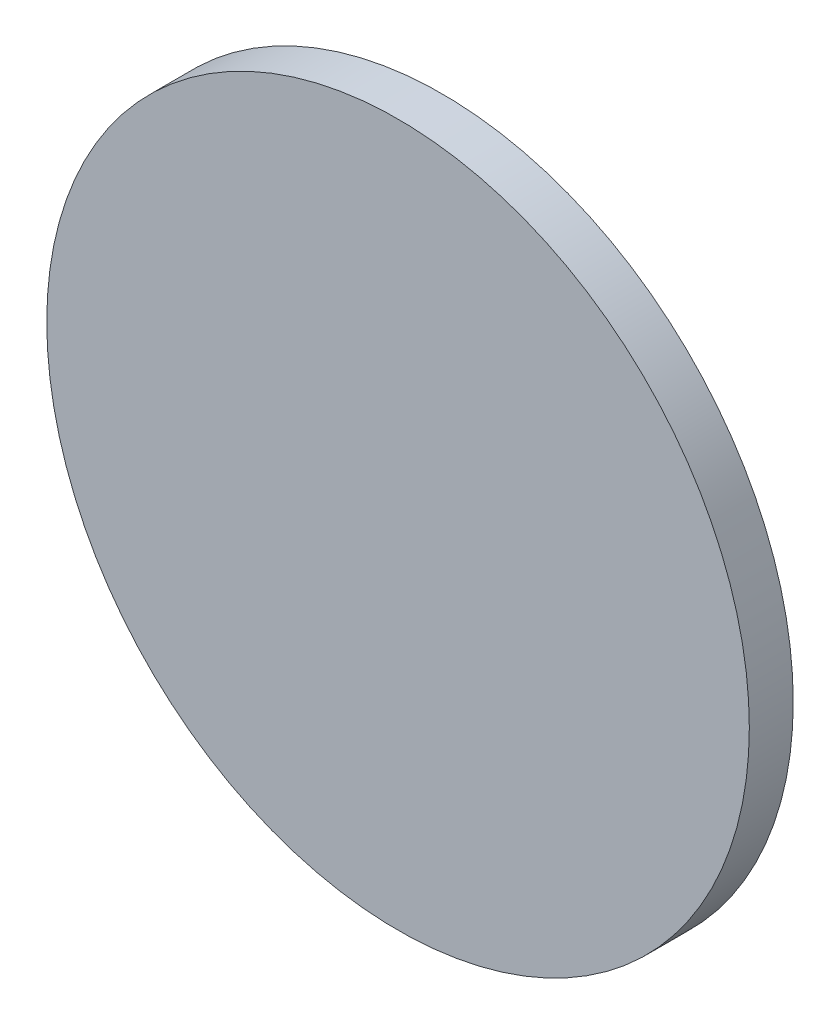
from build123d import *

# Parameters (mm, degrees)
SKETCH_2_R          = 40
EXTRUDE_1_DEPTH     = 5
SKETCH_1_R          = 36.75
SKETCH_1_R_2        = 29.25
SKETCH_1_R_3        = 24.75
SKETCH_1_R_4        = 23.25
CUT_EXTRUDE_1_DEPTH = 2


with BuildPart() as part:
    # 草图2 → 凸台-拉伸1 (new body)
    with BuildSketch(Plane.XY):
        with Locations((0, 0.759664545)):
            Circle(SKETCH_2_R)
    extrude(amount=EXTRUDE_1_DEPTH)

    # 草图1 → 切除-拉伸1 (cut)
    # profile 1 of 2: a face of its own
    with BuildSketch(Plane.XY):
        with Locations((0, 0.759664545)):
            Circle(SKETCH_1_R)
        Circle(SKETCH_1_R_2, mode=Mode.SUBTRACT)
    # profile 2 of 2: a face of its own
    with BuildSketch(Plane.XY):
        Circle(SKETCH_1_R_3)
        Circle(SKETCH_1_R_4, mode=Mode.SUBTRACT)
    extrude(amount=CUT_EXTRUDE_1_DEPTH, mode=Mode.SUBTRACT)


solid = part.part
